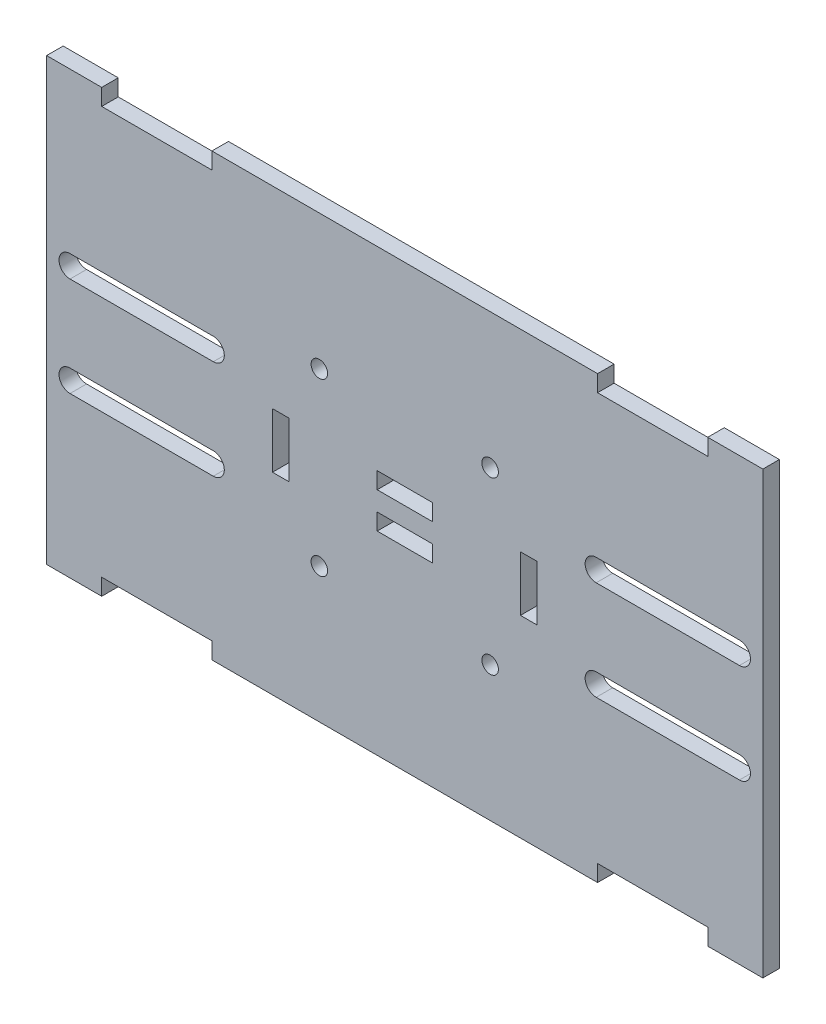
from build123d import *

# Parameters (mm, degrees)
SKETCH1_R           = 1.5
SKETCH1_W           = 3
SKETCH1_H           = 10
BOSS_EXTRUDE1_DEPTH = 3
SKETCH2_W           = 10
SKETCH2_H           = 3
CUT_EXTRUDE2_DEPTH  = 3


with BuildPart() as part:
    # Sketch1 → Boss-Extrude1 (new body)
    with BuildSketch(Plane.XY):
        Polygon((-55, 40), (-55, 37), (-35, 37), (-35, 40), (35, 40), (35, 37), (55, 37), (55, 40), (65, 40), (65, -40), (55, -40), (55, -37), (35, -37), (35, -40), (-35, -40), (-35, -37), (-55, -37), (-55, -40), (-65, -40), (-65, 40), align=None)
        with Locations((15.5, 15.5)):
            Circle(SKETCH1_R, mode=Mode.SUBTRACT)
        with Locations((-15.5, 15.5)):
            Circle(SKETCH1_R, mode=Mode.SUBTRACT)
        with Locations((15.5, -15.5)):
            Circle(SKETCH1_R, mode=Mode.SUBTRACT)
        with Locations((-15.5, -15.5)):
            Circle(SKETCH1_R, mode=Mode.SUBTRACT)
        with Locations((22.5, 0)):
            Rectangle(SKETCH1_W, SKETCH1_H, mode=Mode.SUBTRACT)
        with Locations((-22.5, 0)):
            Rectangle(SKETCH1_W, SKETCH1_H, mode=Mode.SUBTRACT)
        with BuildLine():
            Line((-60.75, 11), (-34.75, 11))
            ThreePointArc((-34.75, 11), (-32.75, 9), (-34.75, 7))
            Line((-34.75, 7), (-60.75, 7))
            ThreePointArc((-60.75, 7), (-62.75, 9), (-60.75, 11))
        make_face(mode=Mode.SUBTRACT)
        with BuildLine():
            Line((-34.75, -7), (-60.75, -7))
            ThreePointArc((-60.75, -7), (-62.75, -9), (-60.75, -11))
            Line((-60.75, -11), (-34.75, -11))
            ThreePointArc((-34.75, -11), (-32.75, -9), (-34.75, -7))
        make_face(mode=Mode.SUBTRACT)
        with BuildLine():
            Line((34.75, 11), (60.75, 11))
            ThreePointArc((60.75, 11), (62.75, 9), (60.75, 7))
            Line((60.75, 7), (34.75, 7))
            ThreePointArc((34.75, 7), (32.75, 9), (34.75, 11))
        make_face(mode=Mode.SUBTRACT)
        with BuildLine():
            Line((34.75, -7), (60.75, -7))
            ThreePointArc((60.75, -7), (62.75, -9), (60.75, -11))
            Line((60.75, -11), (34.75, -11))
            ThreePointArc((34.75, -11), (32.75, -9), (34.75, -7))
        make_face(mode=Mode.SUBTRACT)
    extrude(amount=BOSS_EXTRUDE1_DEPTH)

    # Sketch2 → Cut-Extrude2 (cut)
    with BuildSketch(Plane.XY.offset(3)):
        with Locations((0, 3.25)):
            Rectangle(SKETCH2_W, SKETCH2_H)
        with Locations((0, -3.25)):
            Rectangle(SKETCH2_W, SKETCH2_H)
    extrude(amount=-CUT_EXTRUDE2_DEPTH, mode=Mode.SUBTRACT)


solid = part.part
